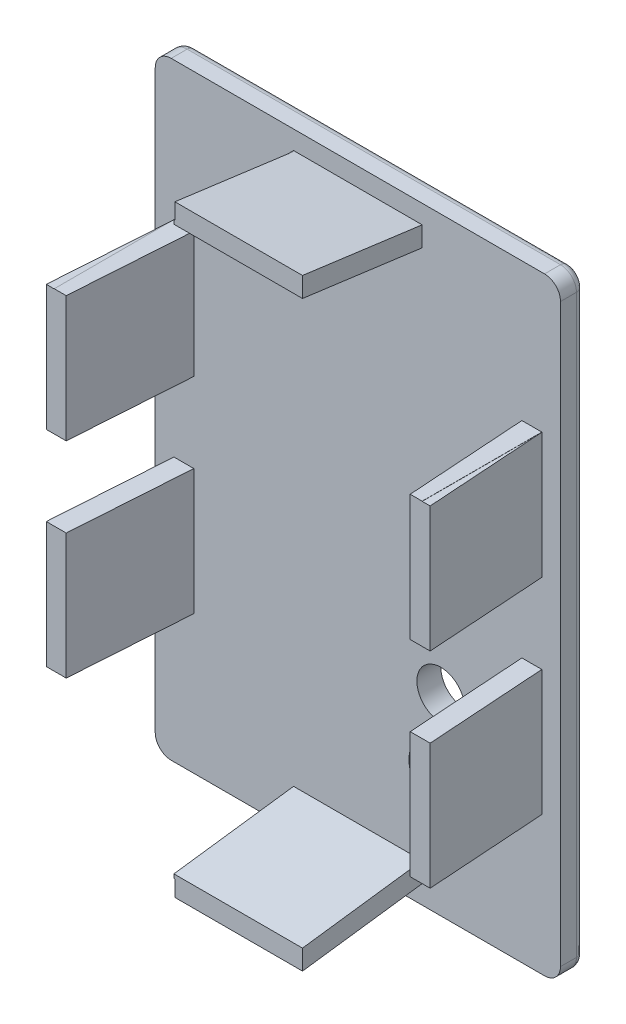
from build123d import *

# Parameters (mm, degrees)
CROQUIS1_W              = 50.8
CROQUIS1_H              = 76.2
SALIENTE_EXTRUIR1_DEPTH = 18
CROQUIS2_W              = 50.8
CROQUIS2_H              = 76.2
CROQUIS2_W_2            = 46.12
CROQUIS2_H_2            = 71.52
CROQUIS2_W_3            = 38.8
CROQUIS2_H_3            = 64.2
CORTAR_EXTRUIR1_DEPTH   = 15
CORTAR_EXTRUIR8_DEPTH   = 15
SALIENTE_EXTRUIR3_DEPTH = 41.5
CORTAR_EXTRUIR9_DEPTH   = 51.5
CORTAR_EXTRUIR10_DEPTH  = 51.5
SALIENTE_EXTRUIR4_DEPTH = 16
CORTAR_EXTRUIR11_DEPTH  = 16.5
REDONDEO3_R             = 2
REDONDEO4_R             = 1
CROQUIS15_W             = 48.12
CROQUIS15_H             = 10
CORTAR_EXTRUIR12_DEPTH  = 15
CROQUIS16_W             = 8
CROQUIS16_H             = 1.5
CORTAR_EXTRUIR13_DEPTH  = 2
CROQUIS17_R             = 4
CROQUIS17_R_2           = 3
CORTAR_EXTRUIR14_DEPTH  = 10


with BuildPart() as part:
    # Croquis1 → Saliente-Extruir1 (new body)
    with BuildSketch(Plane.XY):
        Rectangle(CROQUIS1_W, CROQUIS1_H)
    extrude(amount=SALIENTE_EXTRUIR1_DEPTH)

    # Croquis2 → Cortar-Extruir1 (cut)
    # profile 1 of 2: a face of its own
    with BuildSketch(Plane.XY.offset(18)):
        Rectangle(CROQUIS2_W, CROQUIS2_H)
        Rectangle(CROQUIS2_W_2, CROQUIS2_H_2, mode=Mode.SUBTRACT)
    # profile 2 of 2: a face of its own
    with BuildSketch(Plane.XY.offset(18)):
        Rectangle(CROQUIS2_W_3, CROQUIS2_H_3)
    extrude(amount=-CORTAR_EXTRUIR1_DEPTH, mode=Mode.SUBTRACT)

    # Croquis6 → Cortar-Extruir8 (cut)
    with BuildSketch(Plane.XY.offset(18)):
        Polygon((-23.06, 35.76), (-8.06, 35.76), (-8.06, 32.1), (-19.4, 32.1), (-19.4, 20.76), (-23.06, 20.76), align=None)
        Polygon((23.06, 35.76), (8.06, 35.76), (8.06, 32.1), (19.4, 32.1), (19.4, 20.76), (23.06, 20.76), align=None)
        Polygon((-23.06, -35.76), (-23.06, -20.76), (-19.4, -20.76), (-19.4, -32.1), (-8.06, -32.1), (-8.06, -35.76), align=None)
        Polygon((23.06, -35.76), (8.06, -35.76), (8.06, -32.1), (19.4, -32.1), (19.4, -20.76), (23.06, -20.76), align=None)
    extrude(amount=-CORTAR_EXTRUIR8_DEPTH, mode=Mode.SUBTRACT)

    # Croquis10 → Saliente-Extruir3 (add)
    with BuildSketch(Plane(origin=(0, -20.76, 0), x_dir=(-1, 0, 0), z_dir=(0, -1, 0))):
        Polygon((23.06, -18), (24.06, -18), (23.06, -3), align=None)
        Polygon((-23.06, -18), (-24.06, -18), (-23.06, -3), align=None)
    extrude(amount=-SALIENTE_EXTRUIR3_DEPTH)

    # Croquis11 → Cortar-Extruir9 (cut)
    with BuildSketch(Plane.XZ.offset(20.76)):
        Polygon((-19.4, 18), (-21.56, 18), (-20.56, 3), (-19.4, 3), align=None)
    extrude(amount=-CORTAR_EXTRUIR9_DEPTH, mode=Mode.SUBTRACT)

    # Croquis12 → Cortar-Extruir10 (cut)
    with BuildSketch(Plane.XZ.offset(20.76)):
        Polygon((19.4, 18), (19.4, 3), (20.56, 3), (21.56, 18), align=None)
    extrude(amount=-CORTAR_EXTRUIR10_DEPTH, mode=Mode.SUBTRACT)

    # Croquis13 → Saliente-Extruir4 (add)
    with BuildSketch(Plane(origin=(8.06, 0, 0), x_dir=(0, 0, -1), z_dir=(1, 0, 0))):
        Polygon((-18, -35.76), (-18, -37.76), (-3, -35.76), align=None)
        Polygon((-18, 35.76), (-18, 37.76), (-3, 35.76), align=None)
    extrude(amount=-SALIENTE_EXTRUIR4_DEPTH)

    # Croquis14 → Cortar-Extruir11 (cut)
    with BuildSketch(Plane(origin=(8.06, 0, 0), x_dir=(0, 0, -1), z_dir=(1, 0, 0))):
        Polygon((-3, -32.1), (-18, -32.1), (-18, -35.26), (-3, -33.26), align=None)
        Polygon((-18, 32.1), (-18, 35.26), (-3, 33.26), (-3, 32.1), align=None)
    extrude(amount=-CORTAR_EXTRUIR11_DEPTH, mode=Mode.SUBTRACT)

    # Redondeo3
    redondeo3_edges = [part.edges().sort_by_distance(p)[0] for p in [
        (-25.4, 38.1, 1.5),
        (25.4, 38.1, 1.5),
        (25.4, -38.1, 1.5),
        (-25.4, -38.1, 1.5),
    ]]
    fillet(redondeo3_edges, radius=REDONDEO3_R)

    # Redondeo4
    redondeo4_edges = [part.edges().sort_by_distance(p)[0] for p in [
        (0, 38.1, 0),
        (-25.4, 0, 0),
        (25.4, 0, 0),
        (0, -38.1, 0),
        (24.814213562, -37.514213562, 0),
        (-24.814213562, -37.514213562, 0),
        (-24.814213562, 37.514213562, 0),
        (24.814213562, 37.514213562, 0),
    ]]
    fillet(redondeo4_edges, radius=REDONDEO4_R)

    # Croquis15 → Cortar-Extruir12 (cut)
    with BuildSketch(Plane.XY.offset(18)):
        with Locations((0, -0.01)):
            Rectangle(CROQUIS15_W, CROQUIS15_H)
    extrude(amount=-CORTAR_EXTRUIR12_DEPTH, mode=Mode.SUBTRACT)

    # Croquis16 → Cortar-Extruir13 (cut)
    with BuildSketch(Plane.XZ.offset(38.1)):
        with Locations((0, 2.25)):
            Rectangle(CROQUIS16_W, CROQUIS16_H)
    extrude(amount=-CORTAR_EXTRUIR13_DEPTH, mode=Mode.SUBTRACT)

    # Croquis17 → Cortar-Extruir14 (cut)
    with BuildSketch(Plane.XY.offset(3)):
        with Locations((10.4, -23.1)):
            Circle(CROQUIS17_R)
        with Locations((10.4, -14.1)):
            Circle(CROQUIS17_R_2)
    extrude(amount=-CORTAR_EXTRUIR14_DEPTH, mode=Mode.SUBTRACT)


solid = part.part
